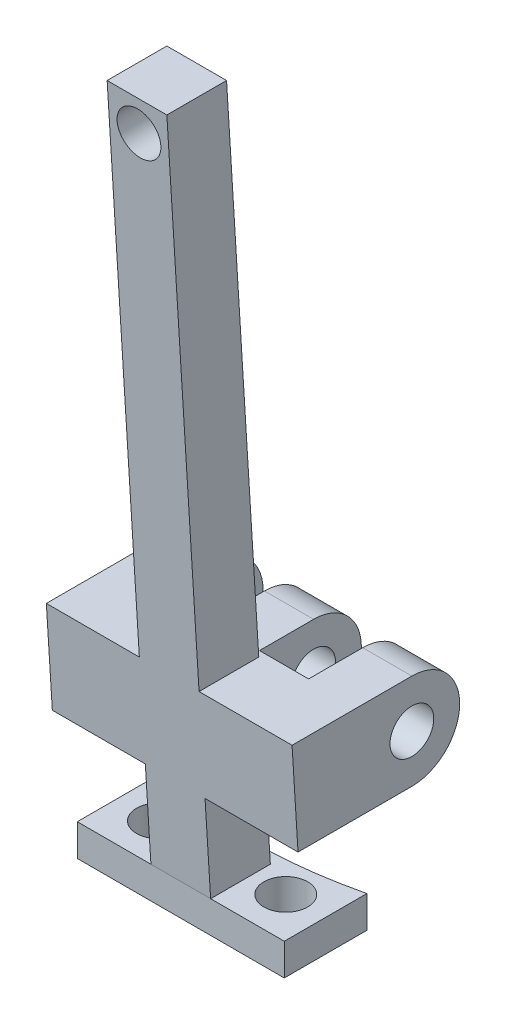
from build123d import *

# Parameters (mm, degrees)
BOSS_EXTRUDE1_DEPTH     = 2
SKETCH2_R               = 1.375
CUT_EXTRUDE1_DEPTH      = 2
CUT_EXTRUDE3_DEPTH      = 47.745974282
CUT_EXTRUDE3_DEPTH_BACK = 47.745974282
SKETCH12_R              = 1.375
BOSS_EXTRUDE2_START     = -1.875
BOSS_EXTRUDE2_DEPTH     = 7.715
SKETCH16_R              = 1.375
BOSS_EXTRUDE3_DEPTH     = 3.086
LPATTERN1_COUNT         = 3
LPATTERN1_PITCH         = 6.172


with BuildPart() as part:
    # Sketch1 → Boss-Extrude1 (new body)
    with BuildSketch(Plane(origin=(0, 0, 0), x_dir=(1, 0, 0), z_dir=(0, 1, 0))):
        with BuildLine():
            Line((-6.5, 0), (6.5, 0))
            Line((6.5, 0), (6.5, 5.19))
            add(Edge.make_bspline(
                [(-6.5, 5.19), (0, 3.63), (6.5, 5.19)],
                knots=[0, 0, 0, 1, 1, 1], degree=2))
            Line((-6.5, 5.19), (-6.5, 0))
        make_face()
    extrude(amount=BOSS_EXTRUDE1_DEPTH)

    # Sketch2 → Cut-Extrude1 (cut)
    with BuildSketch(Plane(origin=(0, 2, 0), x_dir=(1, 0, 0), z_dir=(0, 1, 0))):
        with Locations(Location((-4, 2.595, 0), (0, 0, 270))):
            Circle(SKETCH2_R)
        with Locations(Location((4, 2.595, 0), (0, 0, 270))):
            Circle(SKETCH2_R)
    extrude(amount=-CUT_EXTRUDE1_DEPTH, mode=Mode.SUBTRACT)

    # Sketch4 → Loft2 section 0
    with BuildSketch(Plane(origin=(0, 2, 0), x_dir=(1, 0, 0), z_dir=(0, 1, 0))):
        with BuildLine():
            Line((-1.875, 3.75), (1.875, 3.75))
            Line((1.875, 3.75), (1.875, 0))
            Line((1.875, 0), (-1.875, 0))
            Line((-1.875, 0), (-1.875, 3.75))
        make_face()
    # Sketch6 → Loft2 section 1
    with BuildSketch(Plane(origin=(0, 46, 0), x_dir=(1, 0, 0), z_dir=(0, 1, 0))):
        with BuildLine():
            Line((-1.875, 1), (1.875, 1))
            Line((1.875, 1), (1.875, -2.75))
            Line((1.875, -2.75), (-1.875, -2.75))
            Line((-1.875, -2.75), (-1.875, 1))
        make_face()
    loft()

    # Sketch12 → Cut-Extrude3 (cut, two sides: drawn at the far end of the back side and taken through both)
    with BuildSketch(Plane.XY.offset(-CUT_EXTRUDE3_DEPTH_BACK)):
        with Locations(Location((0, 44, 0), (0, 0, 90))):
            Circle(SKETCH12_R)
    extrude(amount=CUT_EXTRUDE3_DEPTH + CUT_EXTRUDE3_DEPTH_BACK, mode=Mode.SUBTRACT)

    # Sketch13 → Boss-Extrude2 (add)
    with BuildSketch(Plane.ZY.offset(1.875).offset(BOSS_EXTRUDE2_START)):
        Polygon((-3.398125, 13.63), (-3.398125, 7.63), (0.351875, 7.63), (0.726875, 13.63), align=None)
    boss_extrude2 = extrude(amount=BOSS_EXTRUDE2_DEPTH)

    # Mirror1: Boss-Extrude2 across plane
    add(boss_extrude2.mirror(Plane(origin=(0, 0, 0), x_dir=(0, 0, 1), z_dir=(1, 0, 0))))

    # Sketch16 → Boss-Extrude3 (add)
    with BuildSketch(Plane.ZY.offset(7.715)):
        with BuildLine():
            Line((-3.398125, 7.63), (-6.798125, 7.63))
            ThreePointArc((-6.798125, 7.63), (-9.798125, 10.63), (-6.798125, 13.63))
            Line((-6.798125, 13.63), (-3.398125, 13.63))
            Line((-3.398125, 13.63), (-3.398125, 7.63))
        make_face()
        with Locations((-6.798125, 10.63)):
            Circle(SKETCH16_R, mode=Mode.SUBTRACT)
    boss_extrude3 = extrude(amount=-BOSS_EXTRUDE3_DEPTH)

    # LPattern1: Boss-Extrude3 ×3
    with Locations(*[(i * LPATTERN1_PITCH, 0, 0) for i in range(1, LPATTERN1_COUNT)]):
        add(boss_extrude3)


solid = part.part
